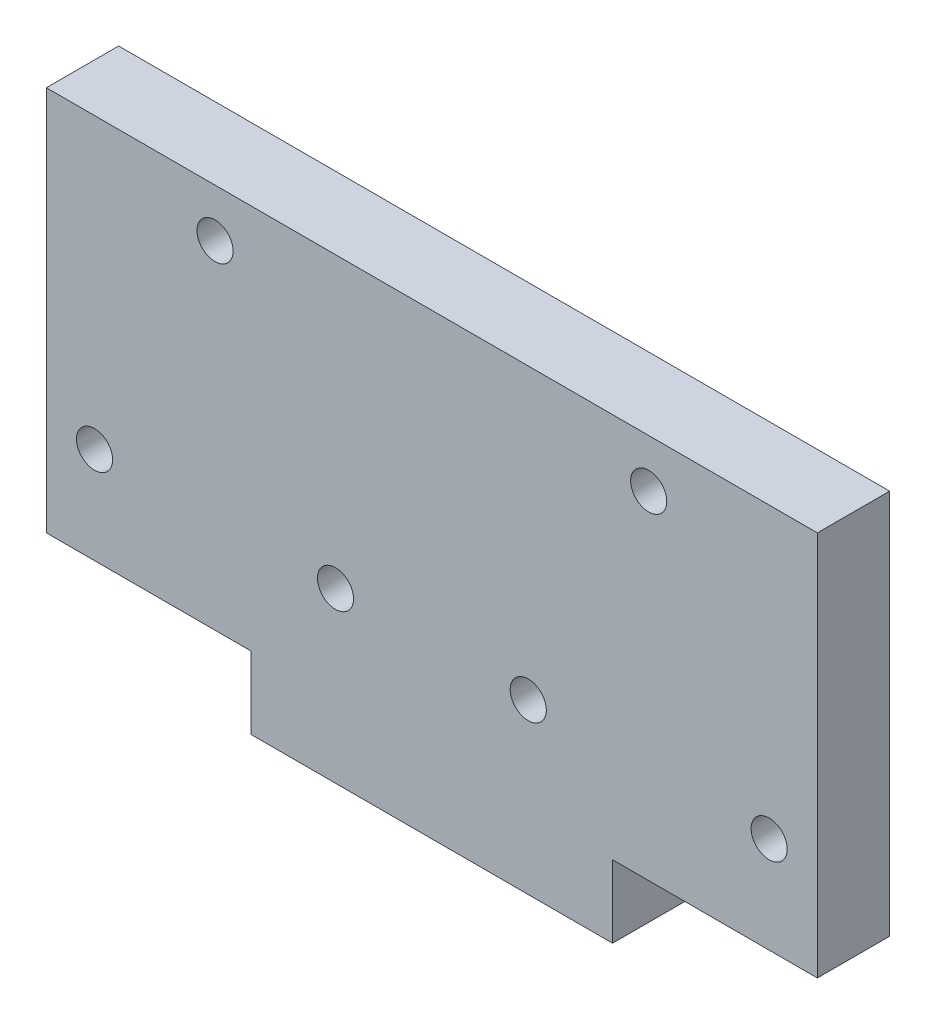
from build123d import *

# Parameters (mm, degrees)
BOSS_EXTRU_1_DEPTH      = 6
ESQUISSE2_R             = 1.5
ENL_V_MAT_EXTRU_1_DEPTH = 75.67261881
ESQUISSE3_R             = 3
ENL_V_MAT_EXTRU_2_DEPTH = 3


with BuildPart() as part:
    # Esquisse1 → Boss.-Extru.1 (new body)
    with BuildSketch(Plane.XY):
        Polygon((0, -32), (-17, -32), (-17, -38), (-47, -38), (-47, -32), (-64, -32), (-64, 0), (0, 0), align=None)
    extrude(amount=BOSS_EXTRU_1_DEPTH)

    # Esquisse2 → Enlèv. mat.-Extru.1 (cut, through all)
    with BuildSketch(Plane(origin=(0, 0, 0), x_dir=(-1, 0, 0), z_dir=(0, 0, -1))):
        with Locations((14, -4)):
            Circle(ESQUISSE2_R)
        with Locations((4, -24)):
            Circle(ESQUISSE2_R)
        with Locations((24, -24)):
            Circle(ESQUISSE2_R)
        with Locations(Location((40, -24, 0), (0, 0, 180))):
            Circle(ESQUISSE2_R)
        with Locations(Location((60, -24, 0), (0, 0, 180))):
            Circle(ESQUISSE2_R)
        with Locations(Location((50, -4, 0), (0, 0, 180))):
            Circle(ESQUISSE2_R)
    extrude(amount=-ENL_V_MAT_EXTRU_1_DEPTH, mode=Mode.SUBTRACT)

    # Esquisse3 → Enlèv. mat.-Extru.2 (cut)
    with BuildSketch(Plane(origin=(0, 0, 0), x_dir=(-1, 0, 0), z_dir=(0, 0, -1))):
        with Locations((14, -4)):
            Circle(ESQUISSE3_R)
        with Locations((4, -24)):
            Circle(ESQUISSE3_R)
        with Locations((24, -24)):
            Circle(ESQUISSE3_R)
        with Locations((40, -24)):
            Circle(ESQUISSE3_R)
        with Locations((60, -24)):
            Circle(ESQUISSE3_R)
        with Locations((50, -4)):
            Circle(ESQUISSE3_R)
    extrude(amount=-ENL_V_MAT_EXTRU_2_DEPTH, mode=Mode.SUBTRACT)


solid = part.part
